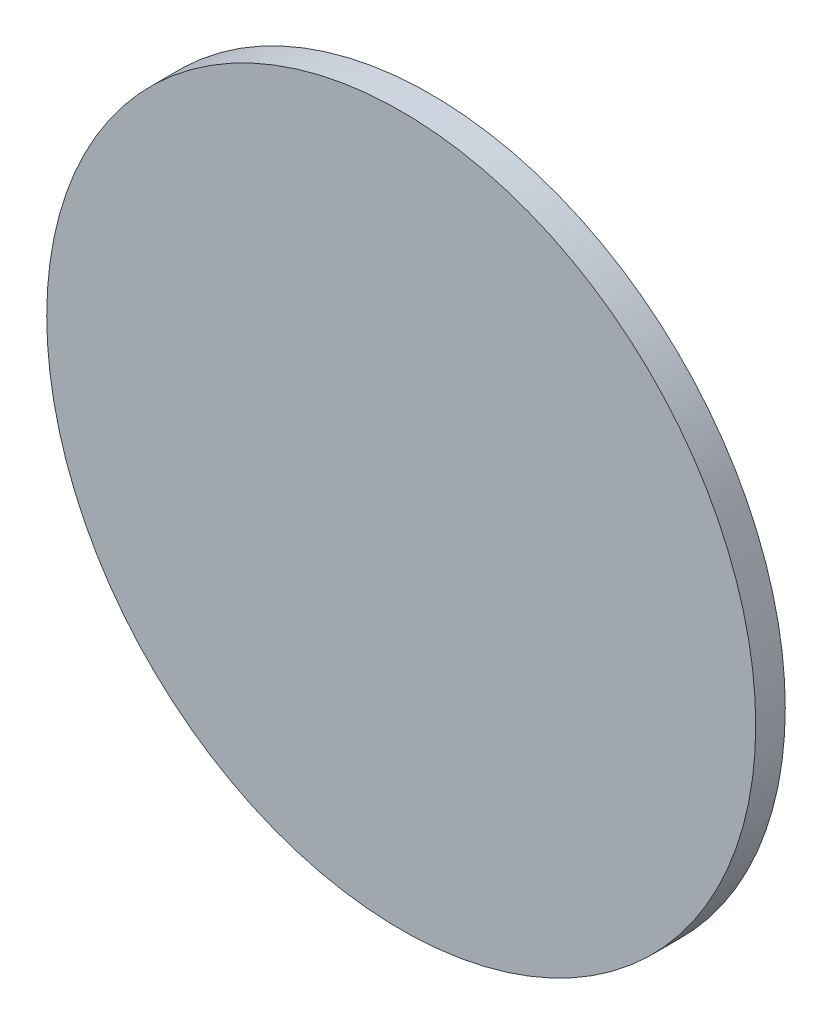
from build123d import *

# Parameters (mm, degrees)
SKETCH1_R           = 152.4
BOSS_EXTRUDE1_DEPTH = 12.7


with BuildPart() as part:
    # Sketch1 → Boss-Extrude1 (new body)
    with BuildSketch(Plane.XY):
        Circle(SKETCH1_R)
    extrude(amount=BOSS_EXTRUDE1_DEPTH)


solid = part.part
